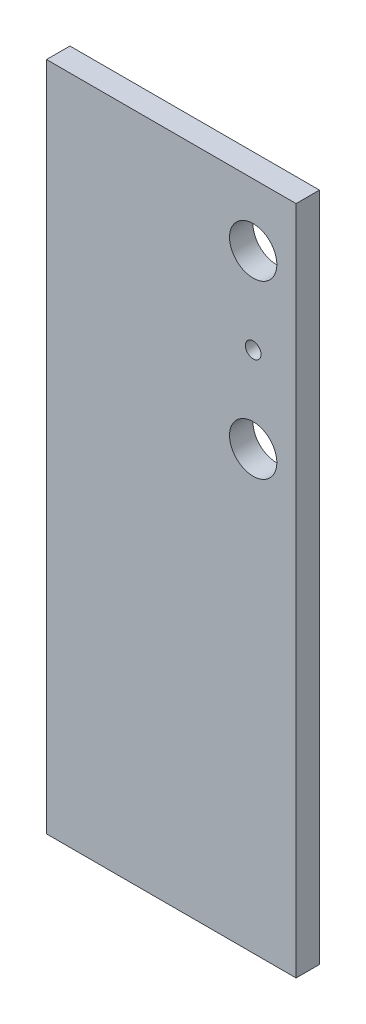
from build123d import *

# Parameters (mm, degrees)
SKETCH1_W               = 203.2
SKETCH1_H               = 546.1
BOSS_EXTRUDE1_DEPTH     = 19.05
SKETCH2_R               = 19.2405
CUT_EXTRUDE1_DEPTH      = 583.990868282
ESQUISSE1_R             = 10.9982
ENL_V_MAT_EXTRU_1_DEPTH = 6.985
ESQUISSE2_R             = 6.35
ENL_V_MAT_EXTRU_2_DEPTH = 583.804439092


with BuildPart() as part:
    # Sketch1 → Boss-Extrude1 (new body)
    with BuildSketch(Plane.XY):
        with Locations((101.6, 273.05)):
            Rectangle(SKETCH1_W, SKETCH1_H)
    extrude(amount=BOSS_EXTRUDE1_DEPTH)

    # Sketch2 → Cut-Extrude1 (cut, through all)
    with BuildSketch(Plane(origin=(0, 0, 0), x_dir=(-1, 0, 0), z_dir=(0, 0, -1))):
        with Locations((-168.275, 495.3)):
            Circle(SKETCH2_R)
        with Locations((-168.275, 355.6)):
            Circle(SKETCH2_R)
    extrude(amount=-CUT_EXTRUDE1_DEPTH, mode=Mode.SUBTRACT)

    # Esquisse1 → Enlèv. mat.-Extru.1 (cut)
    with BuildSketch(Plane(origin=(0, 0, 0), x_dir=(-1, 0, 0), z_dir=(0, 0, -1))):
        with Locations((-168.275, 425.45)):
            Circle(ESQUISSE1_R)
    extrude(amount=-ENL_V_MAT_EXTRU_1_DEPTH, mode=Mode.SUBTRACT)

    # Esquisse2 → Enlèv. mat.-Extru.2 (cut, through all)
    with BuildSketch(Plane(origin=(0, 0, 6.985), x_dir=(-1, 0, 0), z_dir=(0, 0, -1))):
        with Locations((-168.275, 425.45)):
            Circle(ESQUISSE2_R)
    extrude(amount=-ENL_V_MAT_EXTRU_2_DEPTH, mode=Mode.SUBTRACT)


solid = part.part
